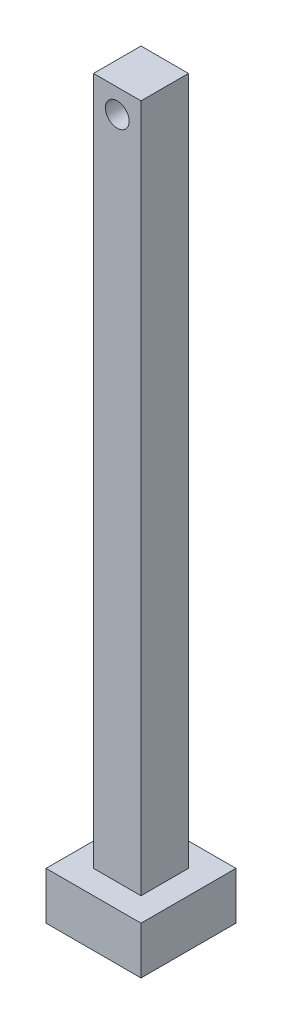
from build123d import *

# Parameters (mm, degrees)
SKETCH1_W           = 20
SKETCH1_H           = 300
SKETCH1_R           = 5
BOSS_EXTRUDE2_DEPTH = 10
SKETCH5_W           = 40
SKETCH5_H           = 40
BOSS_EXTRUDE3_DEPTH = 10


with BuildPart() as part:
    # Sketch1 → Boss-Extrude2 (new, symmetric)
    with BuildSketch(Plane.XY):
        with Locations((10, 150)):
            Rectangle(SKETCH1_W, SKETCH1_H)
        with Locations((10, 290)):
            Circle(SKETCH1_R, mode=Mode.SUBTRACT)
    extrude(amount=BOSS_EXTRUDE2_DEPTH, both=True)

    # Sketch5 → Boss-Extrude3 (add, symmetric)
    with BuildSketch(Plane(origin=(0, 0, 0), x_dir=(1, 0, 0), z_dir=(0, 1, 0))):
        with Locations((10, 0)):
            Rectangle(SKETCH5_W, SKETCH5_H)
    extrude(amount=BOSS_EXTRUDE3_DEPTH, both=True)


solid = part.part
